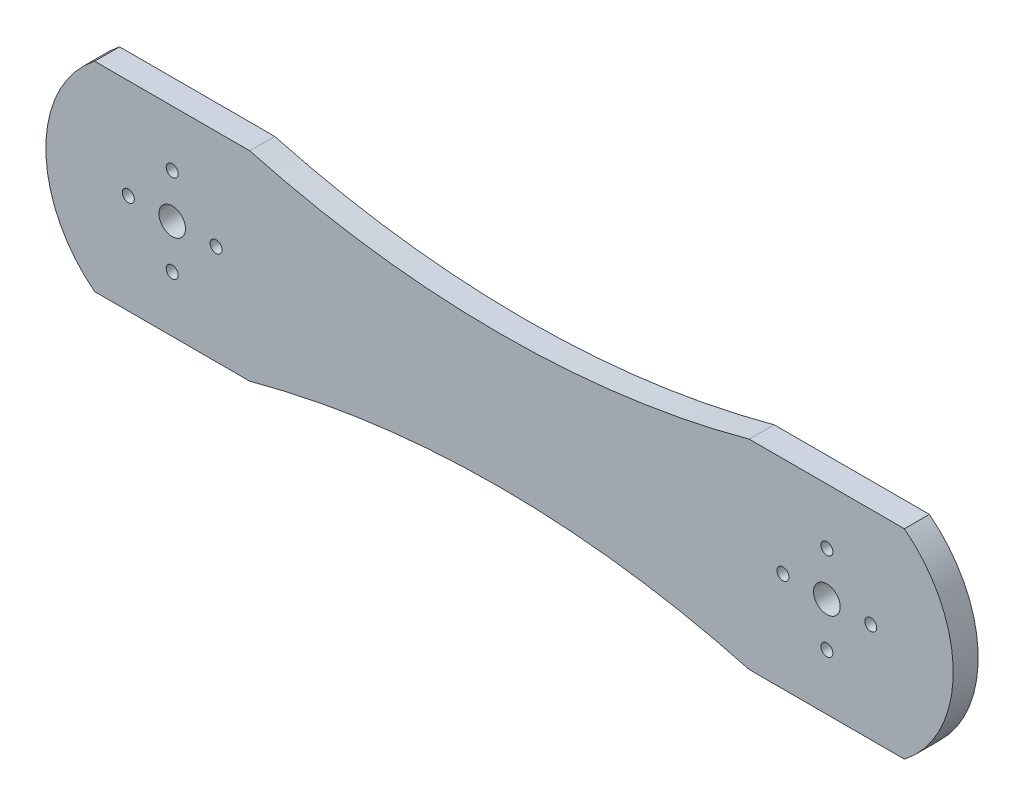
from build123d import *

# Parameters (mm, degrees)
BOSS_EXTRUDE1_DEPTH = 4.7625
SKETCH2_R           = 2.54
SKETCH2_R_2         = 1.143
CUT_EXTRUDE1_DEPTH  = 89.827590344


with BuildPart() as part:
    # Sketch1 → Boss-Extrude1 (new body)
    with BuildSketch(Plane.XY):
        with BuildLine():
            Line((-77.310617813, 19.05), (-47.689382187, 19.05))
            ThreePointArc((-47.689382187, 19.05), (0, 12.7), (47.689382187, 19.05))
            Line((47.689382187, 19.05), (77.310617813, 19.05))
            ThreePointArc((77.310617813, 19.05), (86.63, 0), (77.310617813, -19.05))
            Line((77.310617813, -19.05), (47.689382187, -19.05))
            ThreePointArc((47.689382187, -19.05), (0, -12.7), (-47.689382187, -19.05))
            Line((-47.689382187, -19.05), (-77.310617813, -19.05))
            ThreePointArc((-77.310617813, -19.05), (-86.63, 0), (-77.310617813, 19.05))
        make_face()
    extrude(amount=BOSS_EXTRUDE1_DEPTH)

    # Sketch2 → Cut-Extrude1 (cut, through all)
    with BuildSketch(Plane.XY.offset(4.7625)):
        with Locations((-62.5, 0)):
            Circle(SKETCH2_R)
        with Locations((-54.118, 0)):
            Circle(SKETCH2_R_2)
        with Locations((-62.5, -8.382)):
            Circle(SKETCH2_R_2)
        with Locations((-70.882, 0)):
            Circle(SKETCH2_R_2)
        with Locations((-62.5, 8.382)):
            Circle(SKETCH2_R_2)
        with Locations((62.5, 0)):
            Circle(SKETCH2_R)
        with Locations((70.882, 0)):
            Circle(SKETCH2_R_2)
        with Locations((62.5, -8.382)):
            Circle(SKETCH2_R_2)
        with Locations((54.118, 0)):
            Circle(SKETCH2_R_2)
        with Locations((62.5, 8.382)):
            Circle(SKETCH2_R_2)
    extrude(amount=-CUT_EXTRUDE1_DEPTH, mode=Mode.SUBTRACT)


solid = part.part
